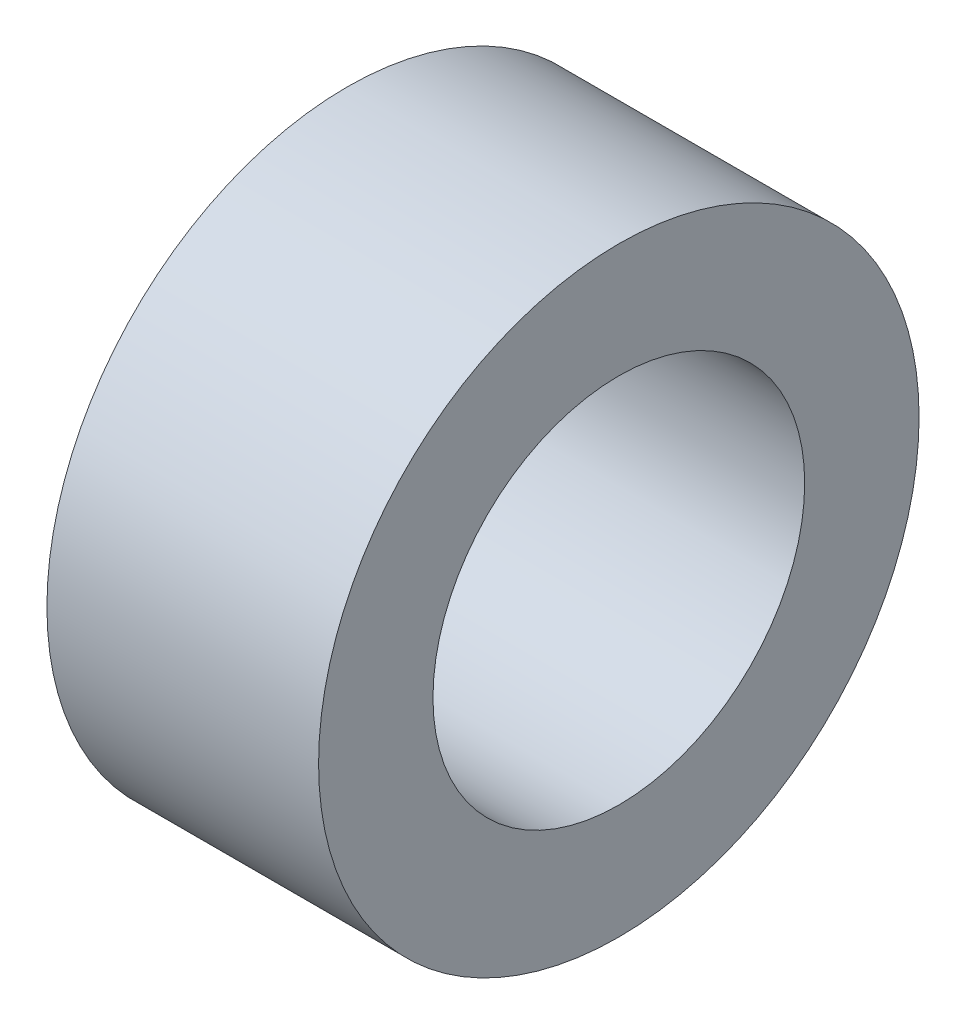
from build123d import *

# Parameters (mm, degrees)
SKETCH1_W          = 19
SKETCH1_H          = 21
SKETCH2_R          = 13
CUT_EXTRUDE1_DEPTH = 36.256205128


with BuildPart() as part:
    # Sketch1 → Revolve-Thin1 (revolve)
    with BuildSketch(Plane(origin=(0, 0, 0), x_dir=(1, 0, 0), z_dir=(0, 1, 0)), mode=Mode.PRIVATE) as revolve_thin1_sk:
        with Locations((9.5, 10.5)):
            Rectangle(SKETCH1_W, SKETCH1_H)
    revolve(revolve_thin1_sk.sketch.rotate(Axis((0, 0, 0), (1, 0, 0)), 180), axis=Axis((0, 0, 0), (1, 0, 0)))

    # Sketch2 → Cut-Extrude1 (cut, through all)
    with BuildSketch(Plane.ZY):
        Circle(SKETCH2_R)
    extrude(amount=-CUT_EXTRUDE1_DEPTH, mode=Mode.SUBTRACT)


solid = part.part
